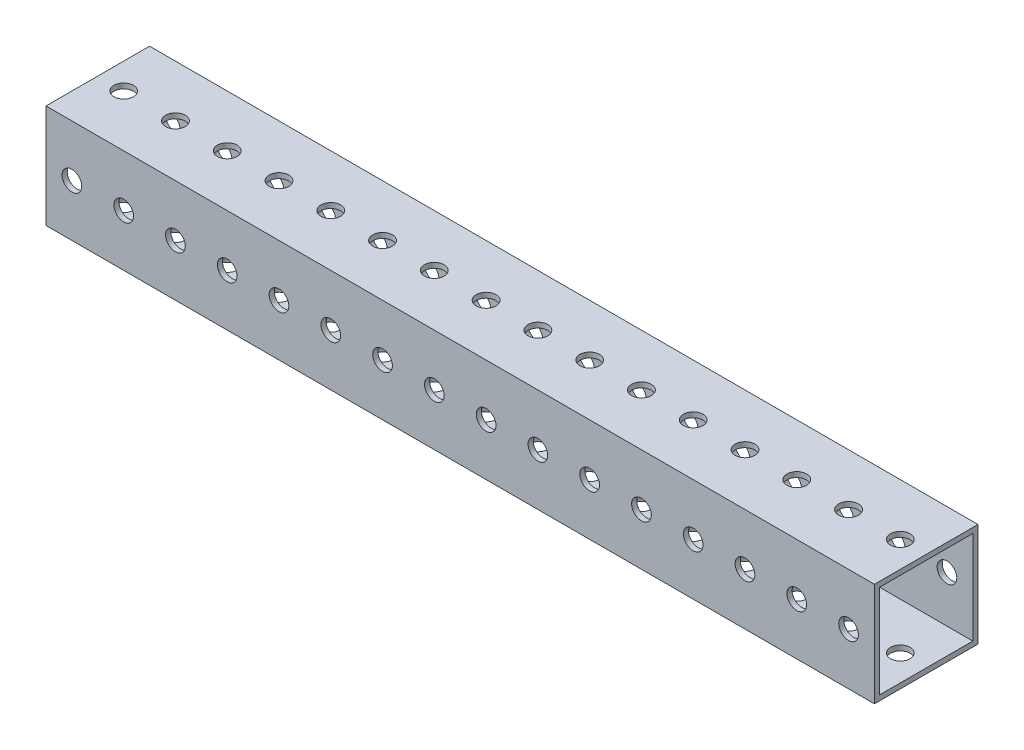
from build123d import *

# Parameters (mm, degrees)
SKETCH1_W           = 203.2
SKETCH1_H           = 25.4
BOSS_EXTRUDE1_DEPTH = 25.4
SKETCH2_W           = 22.86
SKETCH2_H           = 22.86
CUT_EXTRUDE1_DEPTH  = 207.350575478
SKETCH3_R           = 2.413
CUT_EXTRUDE2_DEPTH  = 207.350575478
SKETCH4_R           = 2.413
CUT_EXTRUDE3_DEPTH  = 207.350575478


with BuildPart() as part:
    # Sketch1 → Boss-Extrude1 (new body)
    with BuildSketch(Plane(origin=(0, 0, 0), x_dir=(1, 0, 0), z_dir=(0, 1, 0))):
        with Locations((101.6, 12.7)):
            Rectangle(SKETCH1_W, SKETCH1_H)
    extrude(amount=BOSS_EXTRUDE1_DEPTH)

    # Sketch2 → Cut-Extrude1 (cut, through all)
    with BuildSketch(Plane.ZY):
        with Locations((-12.7, 12.7)):
            Rectangle(SKETCH2_W, SKETCH2_H)
    extrude(amount=-CUT_EXTRUDE1_DEPTH, mode=Mode.SUBTRACT)

    # Sketch3 → Cut-Extrude2 (cut, through all)
    with BuildSketch(Plane(origin=(0, 25.4, 0), x_dir=(1, 0, 0), z_dir=(0, 1, 0))):
        with Locations(Location((6.35, 12.7, 0), (0, 0, 270))):
            Circle(SKETCH3_R)
        with Locations(Location((19.05, 12.7, 0), (0, 0, 270))):
            Circle(SKETCH3_R)
        with Locations(Location((31.75, 12.7, 0), (0, 0, 270))):
            Circle(SKETCH3_R)
        with Locations(Location((44.45, 12.7, 0), (0, 0, 270))):
            Circle(SKETCH3_R)
        with Locations(Location((57.15, 12.7, 0), (0, 0, 270))):
            Circle(SKETCH3_R)
        with Locations(Location((69.85, 12.7, 0), (0, 0, 270))):
            Circle(SKETCH3_R)
        with Locations(Location((82.55, 12.7, 0), (0, 0, 270))):
            Circle(SKETCH3_R)
        with Locations(Location((95.25, 12.7, 0), (0, 0, 270))):
            Circle(SKETCH3_R)
        with Locations(Location((107.95, 12.7, 0), (0, 0, 270))):
            Circle(SKETCH3_R)
        with Locations(Location((120.65, 12.7, 0), (0, 0, 270))):
            Circle(SKETCH3_R)
        with Locations(Location((133.35, 12.7, 0), (0, 0, 270))):
            Circle(SKETCH3_R)
        with Locations(Location((146.05, 12.7, 0), (0, 0, 270))):
            Circle(SKETCH3_R)
        with Locations(Location((158.75, 12.7, 0), (0, 0, 270))):
            Circle(SKETCH3_R)
        with Locations(Location((171.45, 12.7, 0), (0, 0, 270))):
            Circle(SKETCH3_R)
        with Locations(Location((184.15, 12.7, 0), (0, 0, 270))):
            Circle(SKETCH3_R)
        with Locations(Location((196.85, 12.7, 0), (0, 0, 270))):
            Circle(SKETCH3_R)
    extrude(amount=-CUT_EXTRUDE2_DEPTH, mode=Mode.SUBTRACT)

    # Sketch4 → Cut-Extrude3 (cut, through all)
    with BuildSketch(Plane(origin=(0, 0, -25.4), x_dir=(-1, 0, 0), z_dir=(0, 0, -1))):
        with Locations((-6.35, 12.7)):
            Circle(SKETCH4_R)
        with Locations((-19.05, 12.7)):
            Circle(SKETCH4_R)
        with Locations((-31.75, 12.7)):
            Circle(SKETCH4_R)
        with Locations((-44.45, 12.7)):
            Circle(SKETCH4_R)
        with Locations((-57.15, 12.7)):
            Circle(SKETCH4_R)
        with Locations((-69.85, 12.7)):
            Circle(SKETCH4_R)
        with Locations((-82.55, 12.7)):
            Circle(SKETCH4_R)
        with Locations((-95.25, 12.7)):
            Circle(SKETCH4_R)
        with Locations((-107.95, 12.7)):
            Circle(SKETCH4_R)
        with Locations((-120.65, 12.7)):
            Circle(SKETCH4_R)
        with Locations((-133.35, 12.7)):
            Circle(SKETCH4_R)
        with Locations((-146.05, 12.7)):
            Circle(SKETCH4_R)
        with Locations((-158.75, 12.7)):
            Circle(SKETCH4_R)
        with Locations((-171.45, 12.7)):
            Circle(SKETCH4_R)
        with Locations((-184.15, 12.7)):
            Circle(SKETCH4_R)
        with Locations((-196.85, 12.7)):
            Circle(SKETCH4_R)
    extrude(amount=-CUT_EXTRUDE3_DEPTH, mode=Mode.SUBTRACT)


solid = part.part
